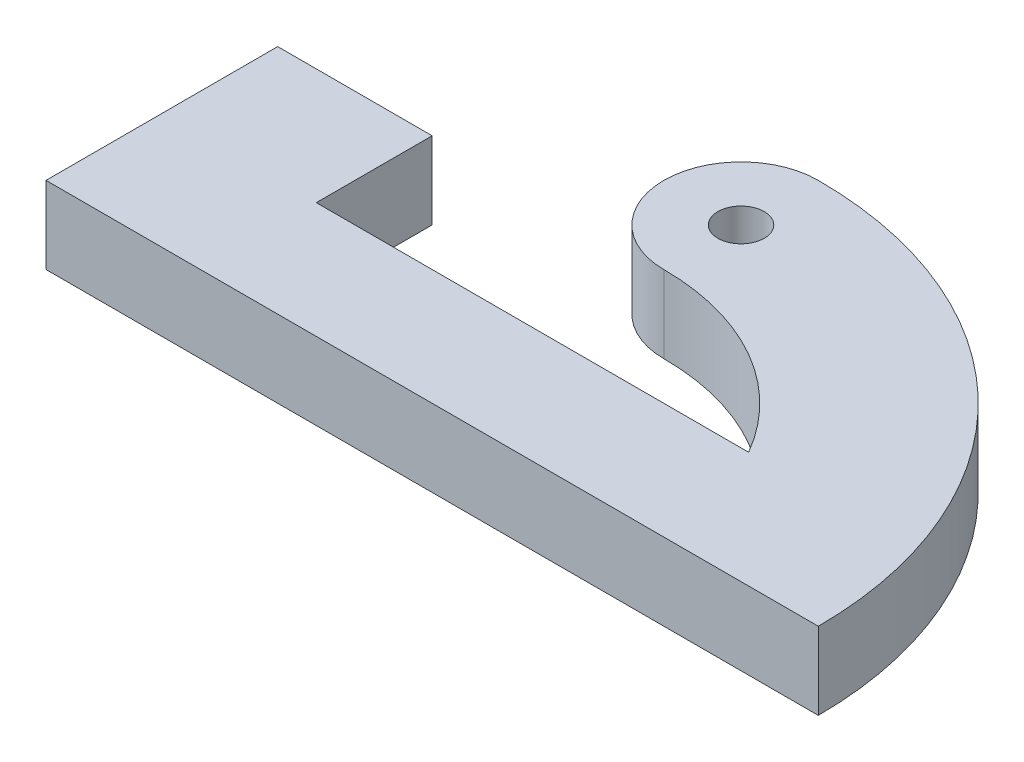
from build123d import *

# Parameters (mm, degrees)
SKETCH_1_R      = 3
EXTRUDE_1_DEPTH = 10


with BuildPart() as part:
    # 草图1 → 凸台-拉伸1 (new body)
    with BuildSketch(Plane(origin=(0, 0, 0), x_dir=(1, 0, 0), z_dir=(0, 1, 0))):
        with BuildLine():
            Line((-50, 0), (0, 0))
            Line((0, 0), (50, 0))
            ThreePointArc((50, 0), (35.355339059, 35.355339059), (0, 50))
            ThreePointArc((0, 50), (-10, 40), (0, 30))
            ThreePointArc((0, 30), (15, 25.980762114), (25.980762114, 15))
            Line((25.980762114, 15), (-30, 15))
            Line((-30, 15), (-30, 30))
            Line((-30, 30), (-50, 30))
            Line((-50, 30), (-50, 0))
        make_face()
        with Locations(Location((0, 40, 0), (0, 0, 270))):
            Circle(SKETCH_1_R, mode=Mode.SUBTRACT)
    extrude(amount=EXTRUDE_1_DEPTH)


solid = part.part
